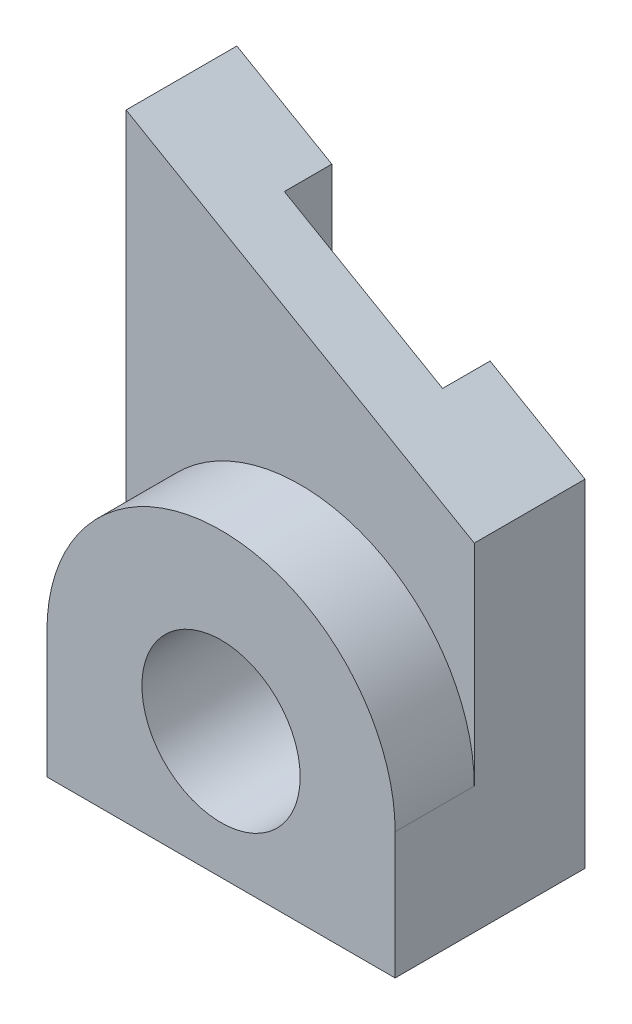
from build123d import *

# Parameters (mm, degrees)
SKETCH1_R           = 10
BOSS_EXTRUDE1_DEPTH = 10
BOSS_EXTRUDE2_START = -14
SKETCH1_3_R         = 10
BOSS_EXTRUDE2_DEPTH = 14
SKETCH3_W           = 20
SKETCH3_H           = 6
CUT_EXTRUDE2_DEPTH  = 73.828565824


with BuildPart() as part:
    # Sketch1 → Boss-Extrude1 (new body)
    with BuildSketch(Plane.XY):
        with BuildLine():
            Line((-22, 0), (-22, -16))
            Line((-22, -16), (22, -16))
            Line((22, -16), (22, 0))
            ThreePointArc((22, 0), (0, 22), (-22, 0))
        make_face()
        Circle(SKETCH1_R, mode=Mode.SUBTRACT)
    extrude(amount=BOSS_EXTRUDE1_DEPTH)

    # Sketch1<3> → Boss-Extrude2 (add)
    with BuildSketch(Plane.XY.offset(BOSS_EXTRUDE2_START)):
        Polygon((-22, -16), (22, -16), (22, 26.596588156), (-22, 52), align=None)
        Circle(SKETCH1_3_R, mode=Mode.SUBTRACT)
    extrude(amount=BOSS_EXTRUDE2_DEPTH)

    # Sketch3 → Cut-Extrude2 (cut, through all)
    with BuildSketch(Plane.XZ.offset(16)):
        with Locations((0, -11)):
            Rectangle(SKETCH3_W, SKETCH3_H)
    extrude(amount=-CUT_EXTRUDE2_DEPTH, mode=Mode.SUBTRACT)


solid = part.part
